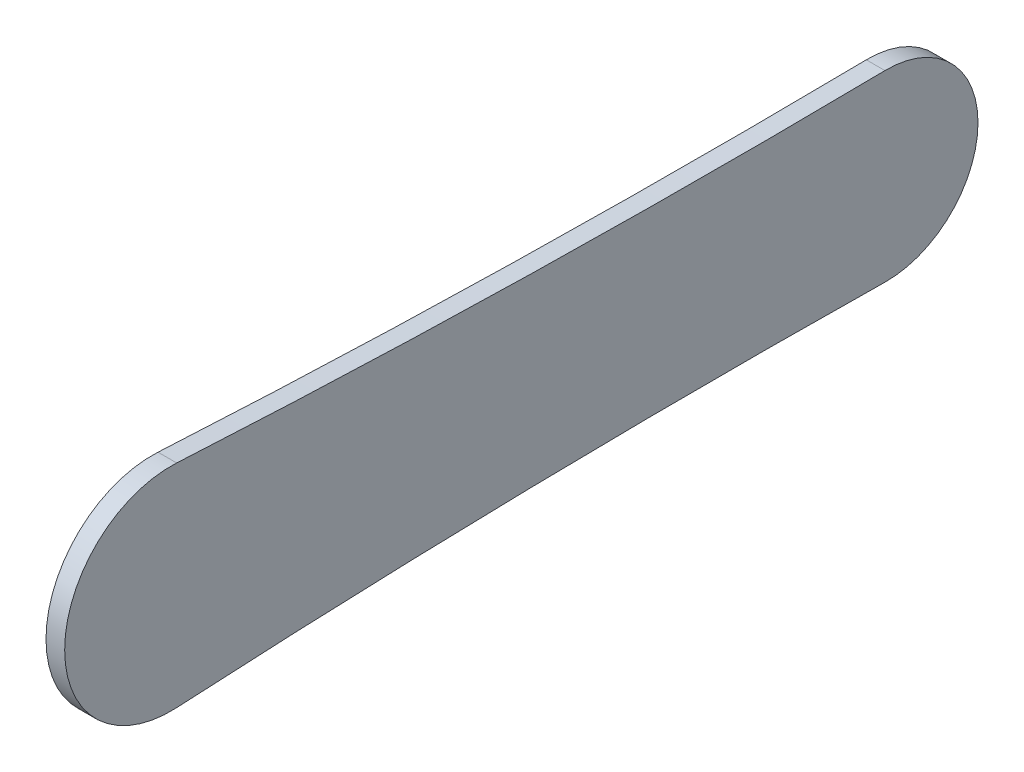
from build123d import *

# Parameters (mm, degrees)
BOSS_EXTRUDE1_DEPTH = 3


with BuildPart() as part:
    # Sketch1 → Boss-Extrude1 (new body)
    with BuildSketch(Plane(origin=(0, 0, 0), x_dir=(0, 0, -1), z_dir=(1, 0, 0))):
        with BuildLine():
            ThreePointArc((-22.182780604, 30.174322804), (34.710157315, 28.014977126), (91.643883369, 27.873568683))
            ThreePointArc((91.643883369, 27.873568683), (106.597825612, 13.145843266), (91.643883369, -1.581882151))
            ThreePointArc((91.643883369, -1.581882151), (34.710157315, -1.723290594), (-22.182780604, -3.882636272))
            ThreePointArc((-22.182780604, -3.882636272), (-40.186504418, 13.145843266), (-22.182780604, 30.174322804))
        make_face()
    extrude(amount=BOSS_EXTRUDE1_DEPTH)


solid = part.part
